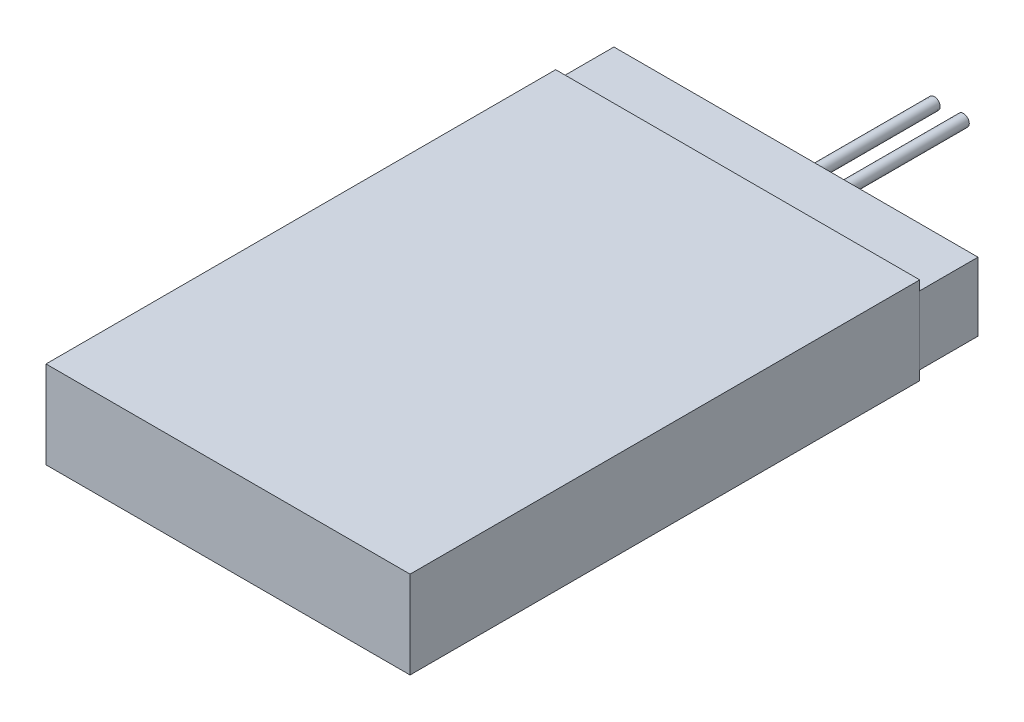
from build123d import *

# Parameters (mm, degrees)
SKETCH1_W             = 25
SKETCH1_H             = 35
BOSS_EXTRUDE1_DEPTH   = 6
SKETCH2_W             = 4
SKETCH2_H             = 4.7
BOSS_EXTRUDE2_DEPTH   = 25
SKETCH3_R             = 0.4
BOSS_EXTRUDE3_DEPTH   = 10
BOSS_EXTRUDE3_2_DEPTH = 10


with BuildPart() as part:
    # Sketch1 → Boss-Extrude1 (new body)
    with BuildSketch(Plane(origin=(0, 0, 0), x_dir=(1, 0, 0), z_dir=(0, 1, 0))):
        with Locations((12.5, 17.5)):
            Rectangle(SKETCH1_W, SKETCH1_H)
    extrude(amount=BOSS_EXTRUDE1_DEPTH)


with BuildPart() as body_2:
    # Sketch2 → Boss-Extrude2 (new body)
    with BuildSketch(Plane(origin=(25, 0, 0), x_dir=(0, 0, -1), z_dir=(1, 0, 0))):
        with Locations((37, 3)):
            Rectangle(SKETCH2_W, SKETCH2_H)
    extrude(amount=-BOSS_EXTRUDE2_DEPTH)


with BuildPart() as body_3:
    # Sketch3 → Boss-Extrude3 (new body)
    with BuildSketch(Plane(origin=(0, 0, -39), x_dir=(-1, 0, 0), z_dir=(0, 0, -1))):
        with Locations((-14, 3)):
            Circle(SKETCH3_R)
    extrude(amount=BOSS_EXTRUDE3_DEPTH)


with BuildPart() as body_4:
    # Sketch3 → Boss-Extrude3 2 (new body)
    with BuildSketch(Plane(origin=(0, 0, -39), x_dir=(-1, 0, 0), z_dir=(0, 0, -1))):
        with Locations((-12, 3)):
            Circle(SKETCH3_R)
    extrude(amount=BOSS_EXTRUDE3_2_DEPTH)


solid = Compound([part.part, body_2.part, body_3.part, body_4.part])
